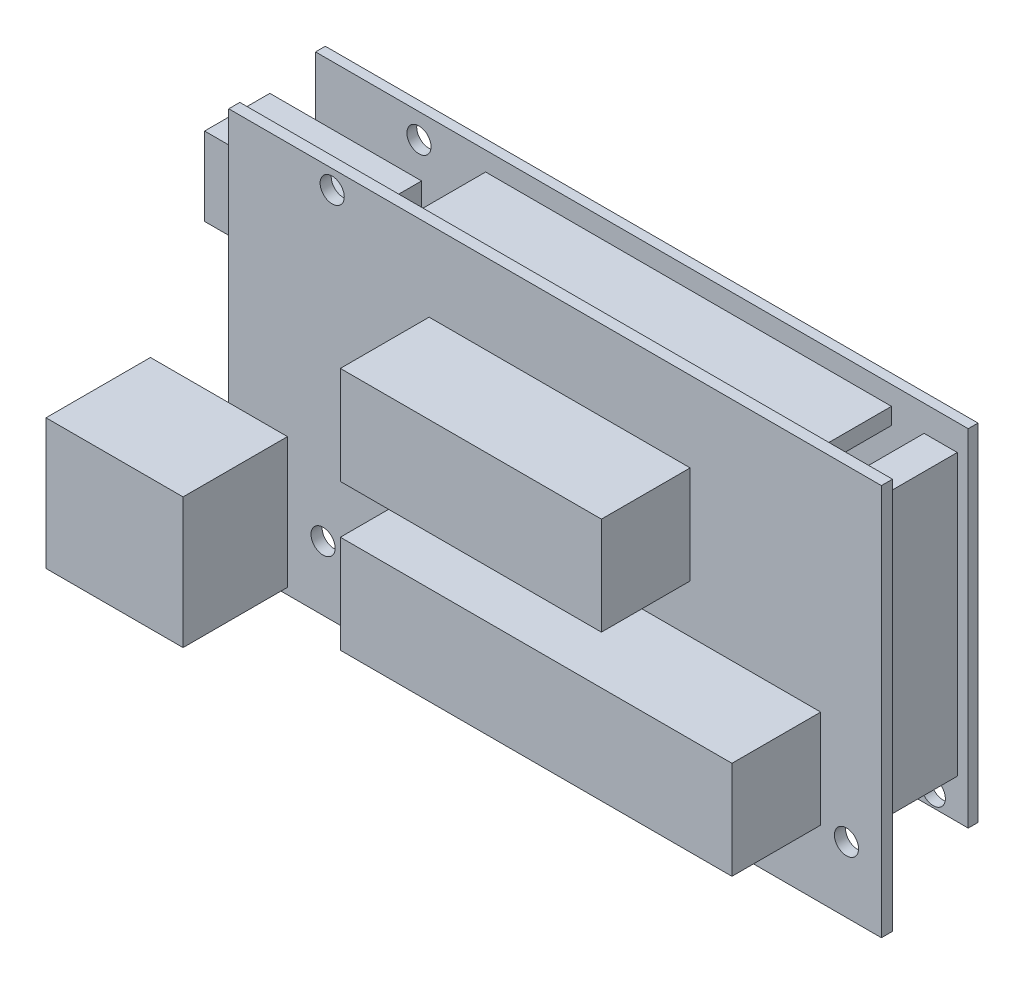
from build123d import *

# Parameters (mm, degrees)
ESBO_O1_W                 = 100
ESBO_O1_H                 = 60
ESBO_O1_R                 = 1.85
RESSALTO_EXTRUS_O1_DEPTH  = 1.7
ESBO_O2_W                 = 60
ESBO_O2_H                 = 15
ESBO_O2_W_2               = 40
RESSALTO_EXTRUS_O2_DEPTH  = 13.6
RESSALTO_EXTRUS_O6_START  = 11.6
ESBO_O3_W                 = 100
ESBO_O3_H                 = 53
ESBO_O3_R                 = 1.85
RESSALTO_EXTRUS_O6_DEPTH  = 1.5
ESBO_O4_W                 = 62.184169383
ESBO_O4_H                 = 2.54
ESBO_O4_W_2               = 5.08
ESBO_O4_H_2               = 42.957805244
ESBO_O4_W_3               = 56.07185462
RESSALTO_EXTRUS_O8_DEPTH  = 11.6
ESBO_O6_W                 = 21
ESBO_O6_H                 = 20
RESSALTO_EXTRUS_O9_DEPTH  = 16
ESBO_O7_W                 = 23.246964405
ESBO_O7_H                 = 12
RESSALTO_EXTRUS_O10_DEPTH = 10


with BuildPart() as part:
    # Esboço1 → Ressalto-extrusão1 (new body)
    with BuildSketch(Plane.XY):
        Rectangle(ESBO_O1_W, ESBO_O1_H)
        with Locations((-34.15, 27.15)):
            Circle(ESBO_O1_R, mode=Mode.SUBTRACT)
        with Locations((-35.55, -20.15)):
            Circle(ESBO_O1_R, mode=Mode.SUBTRACT)
        with Locations((44.65, -19.95)):
            Circle(ESBO_O1_R, mode=Mode.SUBTRACT)
    extrude(amount=RESSALTO_EXTRUS_O1_DEPTH)

    # Esboço2 → Ressalto-extrusão2 (add)
    with BuildSketch(Plane.XY.offset(1.7)):
        with Locations((10.7, -12.2)):
            Rectangle(ESBO_O2_W, ESBO_O2_H)
        with Locations((0.7, 10.2)):
            Rectangle(ESBO_O2_W_2, ESBO_O2_H)
    extrude(amount=RESSALTO_EXTRUS_O2_DEPTH)



with BuildPart() as body_2:
    # Esboço3 → Ressalto-extrusão6 (new body)
    with BuildSketch(Plane(origin=(0, 0, 0), x_dir=(-1, 0, 0), z_dir=(0, 0, -1)).offset(RESSALTO_EXTRUS_O6_START)):
        with Locations((0, 4.4)):
            Rectangle(ESBO_O3_W, ESBO_O3_H)
        with Locations(Location((-44.65, -19.95, 0), (0, 0, 180))):
            Circle(ESBO_O3_R, mode=Mode.SUBTRACT)
        with Locations(Location((34.15, 27.15, 0), (0, 0, 180))):
            Circle(ESBO_O3_R, mode=Mode.SUBTRACT)
        with Locations(Location((35.55, -20.15, 0), (0, 0, 180))):
            Circle(ESBO_O3_R, mode=Mode.SUBTRACT)
    extrude(amount=RESSALTO_EXTRUS_O6_DEPTH)


with BuildPart() as part_1:
    add(part.part)

    add(body_2.part)  # Ressalto-extrusão8 merges body 2
    # Esboço4 → Ressalto-extrusão8 (add)
    with BuildSketch(Plane.XY.offset(-11.6)):
        with Locations((7.150543675, 26.719832293)):
            Rectangle(ESBO_O4_W, ESBO_O4_H)
        with Locations((45.784919315, 5.42627648)):
            Rectangle(ESBO_O4_W_2, ESBO_O4_H_2)
        with Locations((10.206701056, -18.689881399)):
            Rectangle(ESBO_O4_W_3, ESBO_O4_H)
    extrude(amount=RESSALTO_EXTRUS_O8_DEPTH)

    # Esboço6 → Ressalto-extrusão9 (add)
    with BuildSketch(Plane.XY.offset(1.7)):
        with Locations((-51.5, -19)):
            Rectangle(ESBO_O6_W, ESBO_O6_H)
    extrude(amount=RESSALTO_EXTRUS_O9_DEPTH)

    # Esboço7 → Ressalto-extrusão10 (add)
    with BuildSketch(Plane.XY.offset(-11.6)):
        with Locations((-45.376517798, 15.9)):
            Rectangle(ESBO_O7_W, ESBO_O7_H)
    extrude(amount=RESSALTO_EXTRUS_O10_DEPTH)


solid = part_1.part
